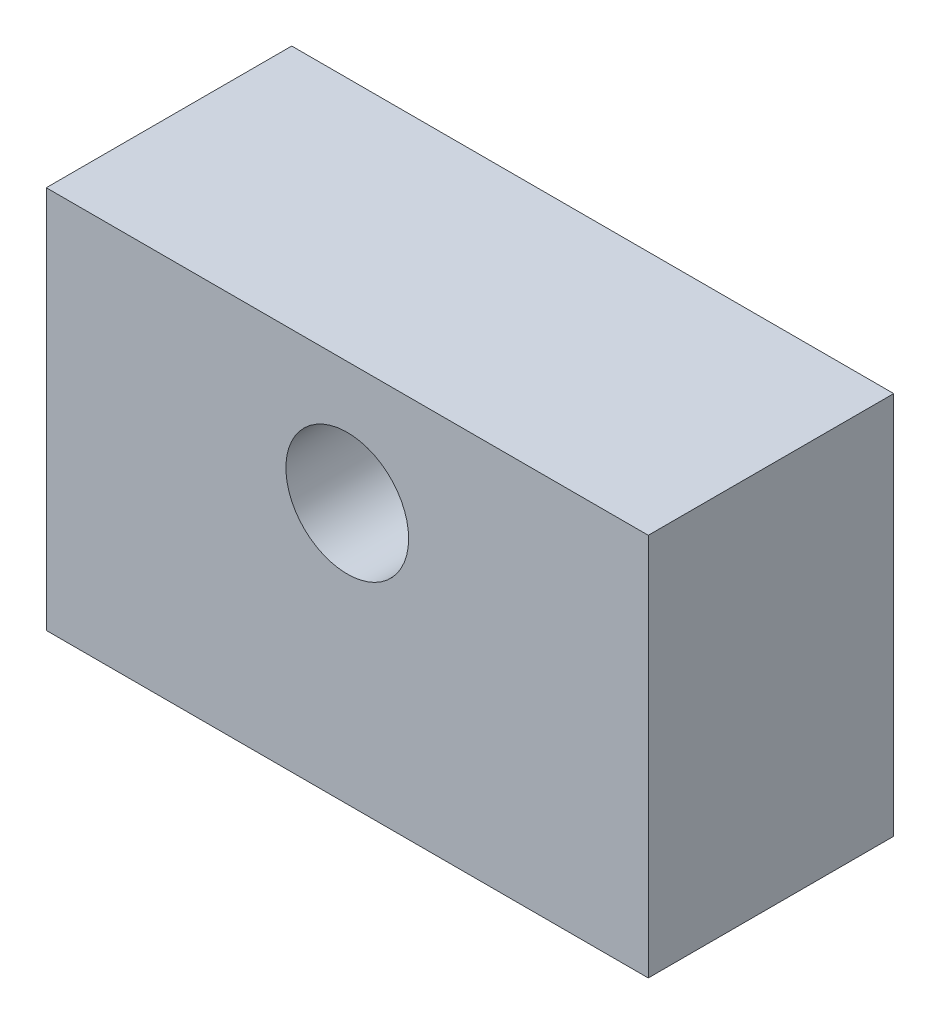
from build123d import *

# Parameters (mm, degrees)
SKETCH3_W                      = 31.148374891
SKETCH3_H                      = 19.837641971
BOSS_EXTRUDE1_DEPTH            = 6.35
SKETCH4_R                      = 3.175
CUT_EXTRUDE1_DEPTH             = 9.525
SKETCH5_R                      = 3.175
CUT_EXTRUDE5_DEPTH             = 9.525
CUT_EXTRUDE5_DIRECTION_2_REACH = 33.299
SKETCH6_R                      = 3.175
CUT_EXTRUDE6_DEPTH             = 9.525


with BuildPart() as part:
    # Sketch3 → Boss-Extrude1 (new, symmetric)
    with BuildSketch(Plane.XY):
        with Locations((15.574187446, -9.918820986)):
            Rectangle(SKETCH3_W, SKETCH3_H)
    extrude(amount=BOSS_EXTRUDE1_DEPTH, both=True)

    # Sketch4 → Cut-Extrude1 (cut)
    with BuildSketch(Plane.ZY):
        with Locations(Location((0, -6.35, 0), (0, 0, 270))):
            Circle(SKETCH4_R)
    extrude(amount=-CUT_EXTRUDE1_DEPTH, mode=Mode.SUBTRACT)

    # Sketch5 → Cut-Extrude5 (cut)
    with BuildSketch(Plane(origin=(7.787093723, -19.837641971, 0), x_dir=(-0.8660254037844382, 0.500000000000001, 0), z_dir=(-0.500000000000001, -0.8660254037844382, 0))):
        with Locations(Location((0, 0, 0), (0, 0, 180))):
            Circle(SKETCH5_R)
    cut_extrude5 = extrude(amount=-CUT_EXTRUDE5_DEPTH, mode=Mode.SUBTRACT)

    # Sketch5 → Cut-Extrude5 direction 2 (cut, up to next)
    with BuildSketch(Plane(origin=(7.787093723, -19.837641971, 0), x_dir=(-0.8660254037844382, 0.500000000000001, 0), z_dir=(-0.500000000000001, -0.8660254037844382, 0)), mode=Mode.PRIVATE) as cut_extrude5_direction_2_sk1:
        with Locations(Location((0, 0, 0), (0, 0, 180))):
            Circle(SKETCH5_R)
    cut_extrude5_direction_2_tool1 = extrude(cut_extrude5_direction_2_sk1.sketch, amount=CUT_EXTRUDE5_DIRECTION_2_REACH, mode=Mode.PRIVATE) & part.part
    cut_extrude5_direction_2 = cut_extrude5_direction_2_tool1.solids().sort_by_distance((7.787094, -19.837642, 0))[0]
    add(cut_extrude5_direction_2, mode=Mode.SUBTRACT)

    # Sketch6 → Cut-Extrude6 (cut)
    with BuildSketch(Plane(origin=(0, 0, 6.35), x_dir=(-1, 0, 0), z_dir=(0, 0, -1))):
        with Locations(Location((-15.574187445, -6.35, 0), (0, 0, 180))):
            Circle(SKETCH6_R)
    extrude(amount=CUT_EXTRUDE6_DEPTH, mode=Mode.SUBTRACT)

    # Mirror1: Cut-Extrude5, Cut-Extrude5 direction 2 across plane
    add(cut_extrude5.mirror(Plane.ZY.offset(-15.574187445)), mode=Mode.SUBTRACT)
    add(cut_extrude5_direction_2.mirror(Plane.ZY.offset(-15.574187445)), mode=Mode.SUBTRACT)


solid = part.part
